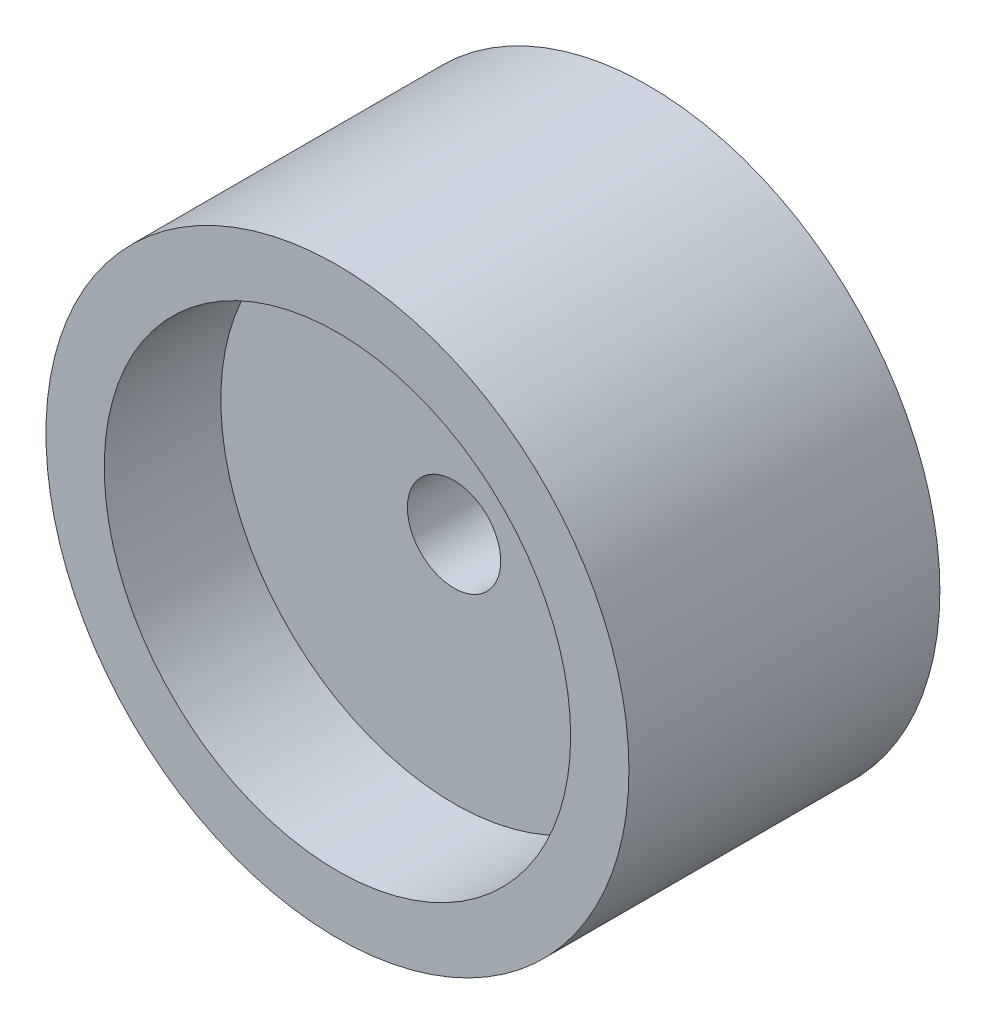
from build123d import *

# Parameters (mm, degrees)
SKETCH_1_R          = 7.5
EXTRUDE_1_DEPTH     = 8
SKETCH_2_R          = 6
CUT_EXTRUDE_1_DEPTH = 3


with BuildPart() as part:
    # 스케치1 → 보스-돌출1 (new body)
    with BuildSketch(Plane.XY):
        Circle(SKETCH_1_R)
    extrude(amount=EXTRUDE_1_DEPTH)

    # 스케치2 → 컷-돌출1 (cut)
    with BuildSketch(Plane.XY.offset(8)):
        Circle(SKETCH_2_R)
    extrude(amount=-CUT_EXTRUDE_1_DEPTH, mode=Mode.SUBTRACT)

    # 스케치4 → M2 소켓 머리 캡 나사용 카운터보어1 (revolve, cut)
    with BuildSketch(Plane.YZ):
        Polygon((0, 0), (0, 5.721032743), (1.2, 5), (1.2, 2), (2.25, 2), (2.25, 0.025), (2.275, 0), align=None)
    revolve(axis=Axis((0, 0, -6.35), (0, 0, 1)), mode=Mode.SUBTRACT)


solid = part.part
